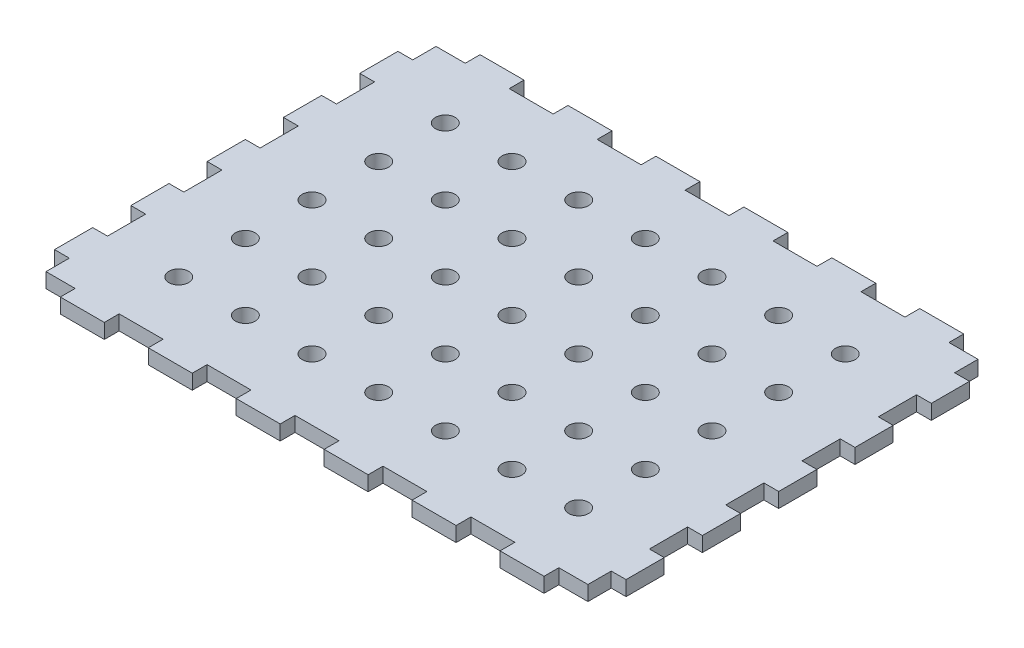
from build123d import *

# Parameters (mm, degrees)
ESBO_O1_W                = 231.5
ESBO_O1_H                = 170
ESBO_O1_R                = 4
RESSALTO_EXTRUS_O1_DEPTH = 6
ESBO_O6_W                = 17.807692308
ESBO_O6_H                = 6
ESBO_O6_W_2              = 17.78
CORTE_EXTRUS_O1_DEPTH    = 6
CORTE_EXTRUS_O2_REACH    = 145.733
ESBO_O7_W                = 6
ESBO_O7_H                = 15.454545455


with BuildPart() as part:
    # Esboço1 → Ressalto-extrusão1 (new body)
    with BuildSketch(Plane(origin=(0, 0, 0), x_dir=(1, 0, 0), z_dir=(0, 1, 0))):
        Rectangle(ESBO_O1_W, ESBO_O1_H)
        with Locations(Location((-81, 54, 0), (0, 0, 270))):
            Circle(ESBO_O1_R, mode=Mode.SUBTRACT)
        with Locations(Location((-54, 54, 0), (0, 0, 270))):
            Circle(ESBO_O1_R, mode=Mode.SUBTRACT)
        with Locations(Location((-27, 54, 0), (0, 0, 270))):
            Circle(ESBO_O1_R, mode=Mode.SUBTRACT)
        with Locations(Location((0, 54, 0), (0, 0, 270))):
            Circle(ESBO_O1_R, mode=Mode.SUBTRACT)
        with Locations(Location((27, 54, 0), (0, 0, 270))):
            Circle(ESBO_O1_R, mode=Mode.SUBTRACT)
        with Locations(Location((54, 54, 0), (0, 0, 270))):
            Circle(ESBO_O1_R, mode=Mode.SUBTRACT)
        with Locations(Location((81, 54, 0), (0, 0, 270))):
            Circle(ESBO_O1_R, mode=Mode.SUBTRACT)
        with Locations(Location((-54, 27, 0), (0, 0, 270))):
            Circle(ESBO_O1_R, mode=Mode.SUBTRACT)
        with Locations(Location((-27, 27, 0), (0, 0, 270))):
            Circle(ESBO_O1_R, mode=Mode.SUBTRACT)
        with Locations(Location((0, 27, 0), (0, 0, 270))):
            Circle(ESBO_O1_R, mode=Mode.SUBTRACT)
        with Locations(Location((27, 27, 0), (0, 0, 270))):
            Circle(ESBO_O1_R, mode=Mode.SUBTRACT)
        with Locations(Location((54, 27, 0), (0, 0, 270))):
            Circle(ESBO_O1_R, mode=Mode.SUBTRACT)
        with Locations(Location((81, 27, 0), (0, 0, 270))):
            Circle(ESBO_O1_R, mode=Mode.SUBTRACT)
        with Locations(Location((-54, 0, 0), (0, 0, 270))):
            Circle(ESBO_O1_R, mode=Mode.SUBTRACT)
        with Locations(Location((-27, 0, 0), (0, 0, 270))):
            Circle(ESBO_O1_R, mode=Mode.SUBTRACT)
        with Locations(Location((0, 0, 0), (0, 0, 270))):
            Circle(ESBO_O1_R, mode=Mode.SUBTRACT)
        with Locations(Location((27, 0, 0), (0, 0, 270))):
            Circle(ESBO_O1_R, mode=Mode.SUBTRACT)
        with Locations(Location((54, 0, 0), (0, 0, 270))):
            Circle(ESBO_O1_R, mode=Mode.SUBTRACT)
        with Locations(Location((81, 0, 0), (0, 0, 270))):
            Circle(ESBO_O1_R, mode=Mode.SUBTRACT)
        with Locations(Location((-54, -27, 0), (0, 0, 270))):
            Circle(ESBO_O1_R, mode=Mode.SUBTRACT)
        with Locations(Location((-27, -27, 0), (0, 0, 270))):
            Circle(ESBO_O1_R, mode=Mode.SUBTRACT)
        with Locations(Location((0, -27, 0), (0, 0, 270))):
            Circle(ESBO_O1_R, mode=Mode.SUBTRACT)
        with Locations(Location((27, -27, 0), (0, 0, 270))):
            Circle(ESBO_O1_R, mode=Mode.SUBTRACT)
        with Locations(Location((54, -27, 0), (0, 0, 270))):
            Circle(ESBO_O1_R, mode=Mode.SUBTRACT)
        with Locations(Location((81, -27, 0), (0, 0, 270))):
            Circle(ESBO_O1_R, mode=Mode.SUBTRACT)
        with Locations(Location((-54, -54, 0), (0, 0, 270))):
            Circle(ESBO_O1_R, mode=Mode.SUBTRACT)
        with Locations(Location((-27, -54, 0), (0, 0, 270))):
            Circle(ESBO_O1_R, mode=Mode.SUBTRACT)
        with Locations(Location((0, -54, 0), (0, 0, 270))):
            Circle(ESBO_O1_R, mode=Mode.SUBTRACT)
        with Locations(Location((27, -54, 0), (0, 0, 270))):
            Circle(ESBO_O1_R, mode=Mode.SUBTRACT)
        with Locations(Location((54, -54, 0), (0, 0, 270))):
            Circle(ESBO_O1_R, mode=Mode.SUBTRACT)
        with Locations(Location((81, -54, 0), (0, 0, 270))):
            Circle(ESBO_O1_R, mode=Mode.SUBTRACT)
        with Locations(Location((-81, 27, 0), (0, 0, 270))):
            Circle(ESBO_O1_R, mode=Mode.SUBTRACT)
        with Locations(Location((-81, 0, 0), (0, 0, 270))):
            Circle(ESBO_O1_R, mode=Mode.SUBTRACT)
        with Locations(Location((-81, -27, 0), (0, 0, 270))):
            Circle(ESBO_O1_R, mode=Mode.SUBTRACT)
        with Locations(Location((-81, -54, 0), (0, 0, 270))):
            Circle(ESBO_O1_R, mode=Mode.SUBTRACT)
    extrude(amount=RESSALTO_EXTRUS_O1_DEPTH)

    # Esboço6 → Corte-extrusão1 (cut)
    with BuildSketch(Plane.XZ):
        with Locations((-106.846153846, 82)):
            Rectangle(ESBO_O6_W, ESBO_O6_H)
        with Locations((-71.226153846, 82)):
            Rectangle(ESBO_O6_W, ESBO_O6_H)
        with Locations((-35.606153846, 82)):
            Rectangle(ESBO_O6_W, ESBO_O6_H)
        with Locations((0.013846154, 82)):
            Rectangle(ESBO_O6_W, ESBO_O6_H)
        with Locations((35.633846154, 82)):
            Rectangle(ESBO_O6_W, ESBO_O6_H)
        with Locations((71.253846154, 82)):
            Rectangle(ESBO_O6_W, ESBO_O6_H)
        with Locations((106.86, 82)):
            Rectangle(ESBO_O6_W_2, ESBO_O6_H)
        with Locations((106.86, -82)):
            Rectangle(ESBO_O6_W_2, ESBO_O6_H)
        with Locations((71.253846154, -82)):
            Rectangle(ESBO_O6_W, ESBO_O6_H)
        with Locations((35.633846154, -82)):
            Rectangle(ESBO_O6_W, ESBO_O6_H)
        with Locations((0.013846154, -82)):
            Rectangle(ESBO_O6_W, ESBO_O6_H)
        with Locations((-35.606153846, -82)):
            Rectangle(ESBO_O6_W, ESBO_O6_H)
        with Locations((-71.226153846, -82)):
            Rectangle(ESBO_O6_W, ESBO_O6_H)
        with Locations((-106.846153846, -82)):
            Rectangle(ESBO_O6_W, ESBO_O6_H)
    extrude(amount=-CORTE_EXTRUS_O1_DEPTH, mode=Mode.SUBTRACT)

    # Esboço7 → Corte-extrusão2 (cut, up to next)
    with BuildSketch(Plane.XZ, mode=Mode.PRIVATE) as corte_extrus_o2_sk1:
        with Locations((112.75, -77.272727272)):
            Rectangle(ESBO_O7_W, ESBO_O7_H)
    corte_extrus_o2_tool1 = extrude(corte_extrus_o2_sk1.sketch, amount=-CORTE_EXTRUS_O2_REACH, mode=Mode.PRIVATE) & part.part
    # Esboço7 → Corte-extrusão2 (cut, up to next)
    with BuildSketch(Plane.XZ, mode=Mode.PRIVATE) as corte_extrus_o2_sk2:
        with Locations((-112.75, -77.272727272)):
            Rectangle(ESBO_O7_W, ESBO_O7_H)
    corte_extrus_o2_tool2 = extrude(corte_extrus_o2_sk2.sketch, amount=-CORTE_EXTRUS_O2_REACH, mode=Mode.PRIVATE) & part.part
    # Esboço7 → Corte-extrusão2 (cut, up to next)
    with BuildSketch(Plane.XZ, mode=Mode.PRIVATE) as corte_extrus_o2_sk3:
        with Locations((112.75, -46.362727273)):
            Rectangle(ESBO_O7_W, ESBO_O7_H)
    corte_extrus_o2_tool3 = extrude(corte_extrus_o2_sk3.sketch, amount=-CORTE_EXTRUS_O2_REACH, mode=Mode.PRIVATE) & part.part
    # Esboço7 → Corte-extrusão2 (cut, up to next)
    with BuildSketch(Plane.XZ, mode=Mode.PRIVATE) as corte_extrus_o2_sk4:
        with Locations((112.75, -15.452727273)):
            Rectangle(ESBO_O7_W, ESBO_O7_H)
    corte_extrus_o2_tool4 = extrude(corte_extrus_o2_sk4.sketch, amount=-CORTE_EXTRUS_O2_REACH, mode=Mode.PRIVATE) & part.part
    # Esboço7 → Corte-extrusão2 (cut, up to next)
    with BuildSketch(Plane.XZ, mode=Mode.PRIVATE) as corte_extrus_o2_sk5:
        with Locations((112.75, 15.457272728)):
            Rectangle(ESBO_O7_W, ESBO_O7_H)
    corte_extrus_o2_tool5 = extrude(corte_extrus_o2_sk5.sketch, amount=-CORTE_EXTRUS_O2_REACH, mode=Mode.PRIVATE) & part.part
    # Esboço7 → Corte-extrusão2 (cut, up to next)
    with BuildSketch(Plane.XZ, mode=Mode.PRIVATE) as corte_extrus_o2_sk6:
        with Locations((112.75, 46.367272728)):
            Rectangle(ESBO_O7_W, ESBO_O7_H)
    corte_extrus_o2_tool6 = extrude(corte_extrus_o2_sk6.sketch, amount=-CORTE_EXTRUS_O2_REACH, mode=Mode.PRIVATE) & part.part
    # Esboço7 → Corte-extrusão2 (cut, up to next)
    with BuildSketch(Plane.XZ, mode=Mode.PRIVATE) as corte_extrus_o2_sk7:
        with Locations((112.75, 77.277272728)):
            Rectangle(ESBO_O7_W, ESBO_O7_H)
    corte_extrus_o2_tool7 = extrude(corte_extrus_o2_sk7.sketch, amount=-CORTE_EXTRUS_O2_REACH, mode=Mode.PRIVATE) & part.part
    # Esboço7 → Corte-extrusão2 (cut, up to next)
    with BuildSketch(Plane.XZ, mode=Mode.PRIVATE) as corte_extrus_o2_sk8:
        with Locations((-112.75, -46.362727273)):
            Rectangle(ESBO_O7_W, ESBO_O7_H)
    corte_extrus_o2_tool8 = extrude(corte_extrus_o2_sk8.sketch, amount=-CORTE_EXTRUS_O2_REACH, mode=Mode.PRIVATE) & part.part
    # Esboço7 → Corte-extrusão2 (cut, up to next)
    with BuildSketch(Plane.XZ, mode=Mode.PRIVATE) as corte_extrus_o2_sk9:
        with Locations((-112.75, -15.452727273)):
            Rectangle(ESBO_O7_W, ESBO_O7_H)
    corte_extrus_o2_tool9 = extrude(corte_extrus_o2_sk9.sketch, amount=-CORTE_EXTRUS_O2_REACH, mode=Mode.PRIVATE) & part.part
    # Esboço7 → Corte-extrusão2 (cut, up to next)
    with BuildSketch(Plane.XZ, mode=Mode.PRIVATE) as corte_extrus_o2_sk10:
        with Locations((-112.75, 15.457272728)):
            Rectangle(ESBO_O7_W, ESBO_O7_H)
    corte_extrus_o2_tool10 = extrude(corte_extrus_o2_sk10.sketch, amount=-CORTE_EXTRUS_O2_REACH, mode=Mode.PRIVATE) & part.part
    # Esboço7 → Corte-extrusão2 (cut, up to next)
    with BuildSketch(Plane.XZ, mode=Mode.PRIVATE) as corte_extrus_o2_sk11:
        with Locations((-112.75, 46.367272728)):
            Rectangle(ESBO_O7_W, ESBO_O7_H)
    corte_extrus_o2_tool11 = extrude(corte_extrus_o2_sk11.sketch, amount=-CORTE_EXTRUS_O2_REACH, mode=Mode.PRIVATE) & part.part
    # Esboço7 → Corte-extrusão2 (cut, up to next)
    with BuildSketch(Plane.XZ, mode=Mode.PRIVATE) as corte_extrus_o2_sk12:
        with Locations((-112.75, 77.277272728)):
            Rectangle(ESBO_O7_W, ESBO_O7_H)
    corte_extrus_o2_tool12 = extrude(corte_extrus_o2_sk12.sketch, amount=-CORTE_EXTRUS_O2_REACH, mode=Mode.PRIVATE) & part.part
    add(corte_extrus_o2_tool1.solids().sort_by_distance((112.75, 0, -77.272727))[0], mode=Mode.SUBTRACT)
    add(corte_extrus_o2_tool2.solids().sort_by_distance((-112.75, 0, -77.272727))[0], mode=Mode.SUBTRACT)
    add(corte_extrus_o2_tool3.solids().sort_by_distance((112.75, 0, -46.362727))[0], mode=Mode.SUBTRACT)
    add(corte_extrus_o2_tool4.solids().sort_by_distance((112.75, 0, -15.452727))[0], mode=Mode.SUBTRACT)
    add(corte_extrus_o2_tool5.solids().sort_by_distance((112.75, 0, 15.457273))[0], mode=Mode.SUBTRACT)
    add(corte_extrus_o2_tool6.solids().sort_by_distance((112.75, 0, 46.367273))[0], mode=Mode.SUBTRACT)
    add(corte_extrus_o2_tool7.solids().sort_by_distance((112.75, 0, 77.277273))[0], mode=Mode.SUBTRACT)
    add(corte_extrus_o2_tool8.solids().sort_by_distance((-112.75, 0, -46.362727))[0], mode=Mode.SUBTRACT)
    add(corte_extrus_o2_tool9.solids().sort_by_distance((-112.75, 0, -15.452727))[0], mode=Mode.SUBTRACT)
    add(corte_extrus_o2_tool10.solids().sort_by_distance((-112.75, 0, 15.457273))[0], mode=Mode.SUBTRACT)
    add(corte_extrus_o2_tool11.solids().sort_by_distance((-112.75, 0, 46.367273))[0], mode=Mode.SUBTRACT)
    add(corte_extrus_o2_tool12.solids().sort_by_distance((-112.75, 0, 77.277273))[0], mode=Mode.SUBTRACT)


solid = part.part
